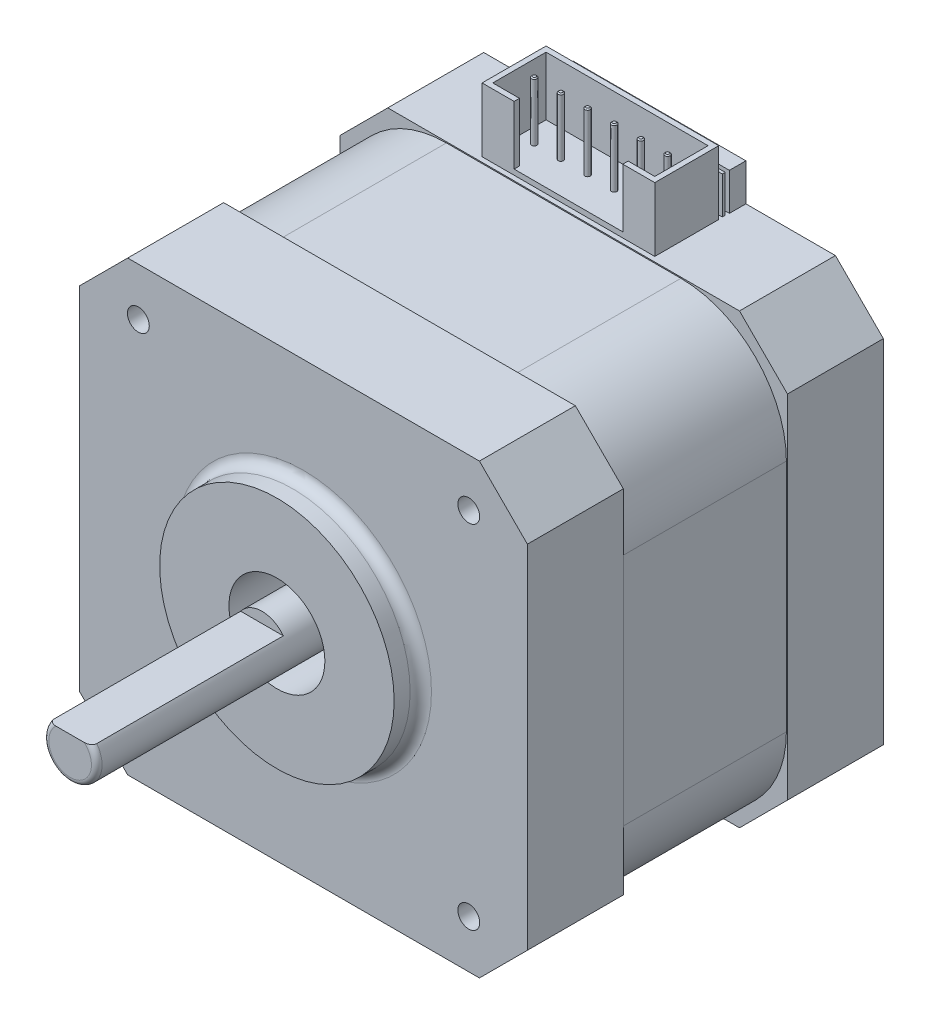
from build123d import *

# Parameters (mm, degrees)
BOSS_EXTRUDE1_DEPTH                = 9
BOSS_EXTRUDE2_DEPTH                = 15.4
BOSS_EXTRUDE3_DEPTH                = 9
SKETCH4_R                          = 4.5
CUT_EXTRUDE1_DEPTH                 = 5
SKETCH5_R                          = 2.5
BOSS_EXTRUDE4_DEPTH                = 26.9
SKETCH6_W                          = 16.2
SKETCH6_H                          = 1.547449217
BOSS_EXTRUDE5_DEPTH                = 3.5
EXTRUDE_THIN4_DEPTH                = 6
BOSS_EXTRUDE7_DEPTH                = 0.5
SKETCH9_W                          = 16.123667198
SKETCH9_H                          = 0.274090176
BOSS_EXTRUDE8_DEPTH                = 3.5
SKETCH10_R                         = 0.25
BOSS_EXTRUDE9_DEPTH                = 5.5
CHAMFER1_SIZE                      = 0.1
BOSS_EXTRUDE10_START               = 2.5
SKETCH11_R                         = 11
SKETCH11_R_2                       = 4.5
BOSS_EXTRUDE10_DEPTH               = 2.5
FILLET1_R                          = 1
CUT_EXTRUDE2_START                 = -18
CUT_EXTRUDE2_DEPTH                 = 18
FILLET2_R                          = 0.5
TAP_DRILL_FOR_M2_5X0_45_TAP2_D     = 2.05
TAP_DRILL_FOR_M2_5X0_45_TAP2_DEPTH = 5
TAP_DRILL_FOR_M2_5X0_45_TAP2_TIP   = 0.615882135


with BuildPart() as part:
    # Sketch1 → Boss-Extrude1 (new body)
    with BuildSketch(Plane.XY):
        Polygon((21, 16.5), (16.5, 21), (-16.5, 21), (-21, 16.5), (-21, -16.5), (-16.5, -21), (16.5, -21), (21, -16.5), align=None)
    extrude(amount=BOSS_EXTRUDE1_DEPTH)

    # Sketch2 → Boss-Extrude2 (add)
    with BuildSketch(Plane.XY.offset(9)):
        with BuildLine():
            Line((11, 20.9), (-11, 20.9))
            ThreePointArc((-11, 20.9), (-18.000357134, 18.000357134), (-20.9, 11))
            Line((-20.9, 11), (-20.9, -11))
            ThreePointArc((-20.9, -11), (-18.000357134, -18.000357134), (-11, -20.9))
            Line((-11, -20.9), (11, -20.9))
            ThreePointArc((11, -20.9), (18.000357134, -18.000357134), (20.9, -11))
            Line((20.9, -11), (20.9, 11))
            ThreePointArc((20.9, 11), (18.000357134, 18.000357134), (11, 20.9))
        make_face()
    extrude(amount=BOSS_EXTRUDE2_DEPTH)

    # Sketch3 → Boss-Extrude3 (add)
    with BuildSketch(Plane.XY.offset(24.4)):
        Polygon((21, -16.5), (21, 16.5), (16.5, 21), (-16.5, 21), (-21, 16.5), (-21, -16.5), (-16.5, -21), (16.5, -21), align=None)
    extrude(amount=BOSS_EXTRUDE3_DEPTH)

    # Sketch4 → Cut-Extrude1 (cut)
    with BuildSketch(Plane.XY.offset(33.4)):
        Circle(SKETCH4_R)
    extrude(amount=-CUT_EXTRUDE1_DEPTH, mode=Mode.SUBTRACT)

    # Sketch5 → Boss-Extrude4 (add)
    with BuildSketch(Plane.XY.offset(28.4)):
        with Locations(Location((0, 0, 0), (0, 0, 180))):
            Circle(SKETCH5_R)
    extrude(amount=BOSS_EXTRUDE4_DEPTH)

    # Sketch6 → Boss-Extrude5 (add)
    with BuildSketch(Plane(origin=(0, 21, 0), x_dir=(1, 0, 0), z_dir=(0, 1, 0))):
        with Locations((0, -0.773724609)):
            Rectangle(SKETCH6_W, SKETCH6_H)
    extrude(amount=BOSS_EXTRUDE5_DEPTH)

    # Sketch7 → Extrude-Thin4 (add)
    with BuildSketch(Plane(origin=(0, 21, 0), x_dir=(1, 0, 0), z_dir=(0, 1, 0))):
        Polygon((-5.1, -8.547449217), (-8.1, -8.547449217), (-8.1, -2.547449217), (8.1, -2.547449217), (8.1, -8.547449217), (5.1, -8.547449217), (5.1, -8.047449217), (7.6, -8.047449217), (7.6, -3.047449217), (-7.6, -3.047449217), (-7.6, -8.047449217), (-5.1, -8.047449217), align=None)
    extrude(amount=EXTRUDE_THIN4_DEPTH)

    # Sketch8 → Boss-Extrude7 (add)
    with BuildSketch(Plane(origin=(0, 21, 0), x_dir=(1, 0, 0), z_dir=(0, 1, 0))):
        Polygon((-5.1, -8.047449217), (-5.1, -8.547449217), (5.1, -8.547449217), (5.1, -8.047449217), (7.6, -8.047449217), (7.6, -3.047449217), (-7.6, -3.047449217), (-7.6, -8.047449217), align=None)
    extrude(amount=BOSS_EXTRUDE7_DEPTH)

    # Sketch9 → Boss-Extrude8 (add)
    with BuildSketch(Plane(origin=(0, 21, 0), x_dir=(1, 0, 0), z_dir=(0, 1, 0))):
        with Locations((0, -2.039705449)):
            Rectangle(SKETCH9_W, SKETCH9_H)
    extrude(amount=BOSS_EXTRUDE8_DEPTH)

    # Sketch10 → Boss-Extrude9 (add)
    with BuildSketch(Plane(origin=(0, 21.5, 0), x_dir=(1, 0, 0), z_dir=(0, 1, 0))):
        with Locations(Location((-6.204552759, -5.547449217, 0), (0, 0, 270))):
            Circle(SKETCH10_R)
        with Locations(Location((-3.704552759, -5.547449217, 0), (0, 0, 270))):
            Circle(SKETCH10_R)
        with Locations(Location((-1.204552759, -5.547449217, 0), (0, 0, 270))):
            Circle(SKETCH10_R)
        with Locations(Location((1.295447241, -5.547449217, 0), (0, 0, 270))):
            Circle(SKETCH10_R)
        with Locations(Location((3.795447241, -5.547449217, 0), (0, 0, 270))):
            Circle(SKETCH10_R)
        with Locations(Location((6.295447241, -5.547449217, 0), (0, 0, 270))):
            Circle(SKETCH10_R)
    extrude(amount=BOSS_EXTRUDE9_DEPTH)

    # Chamfer1
    chamfer1_edges = [part.edges().sort_by_distance(p)[0] for p in [
        (-6.204552759, 27, 5.297449217),
        (-3.704552759, 27, 5.297449217),
        (-1.204552759, 27, 5.297449217),
        (1.295447241, 27, 5.297449217),
        (3.795447241, 27, 5.297449217),
        (6.295447241, 27, 5.297449217),
    ]]
    chamfer(chamfer1_edges, length=CHAMFER1_SIZE)

    # Sketch11 → Boss-Extrude10 (add)
    with BuildSketch(Plane.XY.offset(33.4).offset(BOSS_EXTRUDE10_START)):
        Circle(SKETCH11_R)
        Circle(SKETCH11_R_2, mode=Mode.SUBTRACT)
    extrude(amount=-BOSS_EXTRUDE10_DEPTH)

    # Fillet1
    fillet1_edges = [part.edges().sort_by_distance(p)[0] for p in [
        (-11, 0, 33.4),
    ]]
    fillet(fillet1_edges, radius=FILLET1_R)

    # Sketch12 → Cut-Extrude2 (cut)
    with BuildSketch(Plane.XY.offset(55.3).offset(CUT_EXTRUDE2_START)):
        with BuildLine():
            Line((2, 1.5), (-2, 1.5))
            ThreePointArc((-2, 1.5), (0, 2.5), (2, 1.5))
        make_face()
    extrude(amount=CUT_EXTRUDE2_DEPTH, mode=Mode.SUBTRACT)

    # Fillet2
    fillet2_edges = [part.edges().sort_by_distance(p)[0] for p in [
        (0.790569415, -2.371708245, 55.3),
    ]]
    fillet(fillet2_edges, radius=FILLET2_R)

    # Tap Drill for M2.5x0.45 Tap2
    with Locations(Plane.XY.offset(33.4)):
        with Locations((15.5, 16.5), (15.5, -16.5), (-15.5, -16.5), (-15.5, 16.5)):
            Hole(TAP_DRILL_FOR_M2_5X0_45_TAP2_D / 2, depth=TAP_DRILL_FOR_M2_5X0_45_TAP2_DEPTH)
            with Locations((0, 0, -(TAP_DRILL_FOR_M2_5X0_45_TAP2_DEPTH + TAP_DRILL_FOR_M2_5X0_45_TAP2_TIP / 2))):  # 118° drill point
                Cone(0, TAP_DRILL_FOR_M2_5X0_45_TAP2_D / 2, TAP_DRILL_FOR_M2_5X0_45_TAP2_TIP, mode=Mode.SUBTRACT)


solid = part.part
